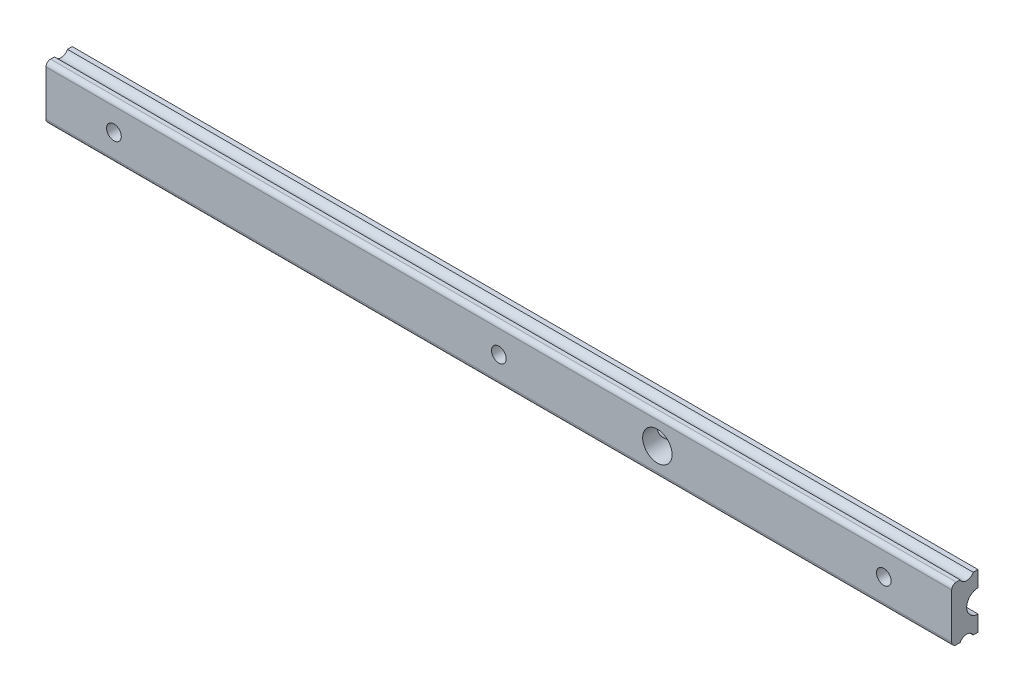
from build123d import *

# Parameters (mm, degrees)
BOSS_EXTRUDE1_DEPTH = 200
FILLET1_R           = 1
SKETCH2_R           = 1.625
CUT_EXTRUDE1_DEPTH  = 201.249843945
TAP1_D              = 3.242
TAP2_D              = 3.242
SKETCH7_R           = 3.25
CUT_EXTRUDE2_DEPTH  = 186.188120672


with BuildPart() as part:
    # Sketch1 → Boss-Extrude1 (new body)
    with BuildSketch(Plane(origin=(-15, 0, 0), x_dir=(0, 0, -1), z_dir=(1, 0, 0))):
        with BuildLine():
            Line((-8, 6), (-2.2, 6))
            Line((-2.2, 6), (-2.2, 2.5))
            ThreePointArc((-2.2, 2.5), (-4.7, 0), (-2.2, -2.5))
            Line((-2.2, -2.5), (-2.2, -6))
            Line((-2.2, -6), (-8, -6))
            Line((-8, -6), (-8, 6))
        make_face()
    extrude(amount=BOSS_EXTRUDE1_DEPTH)

    # Fillet1
    fillet1_edges = [part.edges().sort_by_distance(p)[0] for p in [
        (85, 6, 8),
        (85, -6, 8),
    ]]
    fillet(fillet1_edges, radius=FILLET1_R)

    # Sketch2 → Cut-Extrude1 (cut, through all)
    with BuildSketch(Plane(origin=(-15, 0, 0), x_dir=(0, 0, -1), z_dir=(1, 0, 0))):
        with Locations((-4.7, 6.75)):
            Circle(SKETCH2_R)
        with Locations((-4.7, -6.75)):
            Circle(SKETCH2_R)
    extrude(amount=CUT_EXTRUDE1_DEPTH, mode=Mode.SUBTRACT)

    # Tap1 (through all)
    with Locations(Plane.XY.offset(8)):
        with Locations((0, 0), (170, 0)):
            Hole(TAP1_D / 2)

    # Tap2 (through all)
    with Locations(Plane.XY.offset(8)):
        with Locations((85, 0)):
            Hole(TAP2_D / 2)

    # Sketch7 → Cut-Extrude2 (cut, through all)
    with BuildSketch(Plane.XY.offset(8)):
        with Locations((120, 0)):
            Circle(SKETCH7_R)
    extrude(amount=-CUT_EXTRUDE2_DEPTH, mode=Mode.SUBTRACT)


solid = part.part
